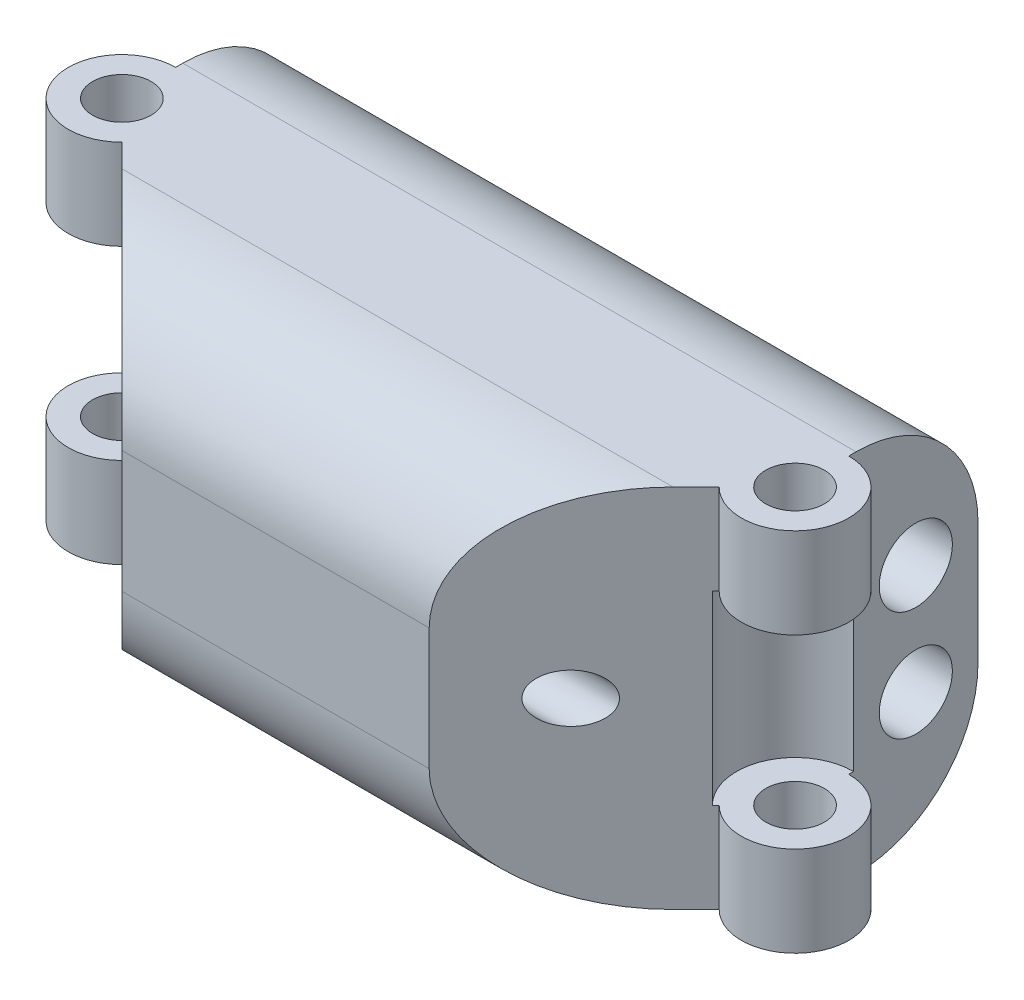
from build123d import *

# Parameters (mm, degrees)
BOSS_EXTRUDE1_DEPTH            = 7.5
BOSS_EXTRUDE1_DEPTH_BACK       = 7.5
CUT_EXTRUDE3_REACH             = 31.568
SKETCH5_R                      = 1.5
FILLET1_R                      = 5
CUT_EXTRUDE2_REACH             = 19.405
SKETCH3_R                      = 1
CUT_EXTRUDE2_DIRECTION_2_REACH = 19.405
FILLET2_R                      = 5
BOSS_EXTRUDE2_START            = 3.8
SKETCH6_R                      = 1.2
BOSS_EXTRUDE2_DEPTH            = 3.7
BOSS_EXTRUDE3_START            = -7.5
SKETCH6_4_R                    = 1.2
BOSS_EXTRUDE3_DEPTH            = 3.7


with BuildPart() as part:
    # Sketch1 → Boss-Extrude1 (new, two sides: drawn at the far end of the back side and taken through both)
    with BuildSketch(Plane(origin=(0, 0, 0), x_dir=(-1, 0, 0), z_dir=(0, 1, 0)).offset(-BOSS_EXTRUDE1_DEPTH_BACK)):
        with BuildLine():
            Line((6.3, 7.5), (-6.3, 7.5))
            Line((-6.3, 7.5), (-12.102943725, 1.697056275))
            ThreePointArc((-12.102943725, 1.697056275), (-11.582689122, -0.918440238), (-13.8, -2.4))
            Line((-13.8, -2.4), (-13.8, -7.5))
            Line((-13.8, -7.5), (13.8, -7.5))
            Line((13.8, -7.5), (13.8, -2.4))
            ThreePointArc((13.8, -2.4), (11.582689122, -0.918440238), (12.102943725, 1.697056275))
            Line((12.102943725, 1.697056275), (6.3, 7.5))
        make_face()
    extrude(amount=BOSS_EXTRUDE1_DEPTH + BOSS_EXTRUDE1_DEPTH_BACK)

    # Sketch5 → Cut-Extrude3 (cut, up to next)
    with BuildSketch(Plane.YZ.offset(13.8), mode=Mode.PRIVATE) as cut_extrude3_sk1:
        with Locations((-2.25, -4.95)):
            Circle(SKETCH5_R)
    cut_extrude3_tool1 = extrude(cut_extrude3_sk1.sketch, amount=-CUT_EXTRUDE3_REACH, mode=Mode.PRIVATE) & part.part
    # Sketch5 → Cut-Extrude3 (cut, up to next)
    with BuildSketch(Plane.YZ.offset(13.8), mode=Mode.PRIVATE) as cut_extrude3_sk2:
        with Locations((2.25, -4.95)):
            Circle(SKETCH5_R)
    cut_extrude3_tool2 = extrude(cut_extrude3_sk2.sketch, amount=-CUT_EXTRUDE3_REACH, mode=Mode.PRIVATE) & part.part
    add(cut_extrude3_tool1.solids().sort_by_distance((13.8, -2.25, -4.95))[0], mode=Mode.SUBTRACT)
    add(cut_extrude3_tool2.solids().sort_by_distance((13.8, 2.25, -4.95))[0], mode=Mode.SUBTRACT)

    # Fillet1
    fillet1_edges = [part.edges().sort_by_distance(p)[0] for p in [
        (0, -7.5, -7.5),
        (0, 7.5, -7.5),
    ]]
    fillet(fillet1_edges, radius=FILLET1_R)

    # Sketch3 → Cut-Extrude2 (cut, up to next)
    with BuildSketch(Plane.YZ, mode=Mode.PRIVATE) as cut_extrude2_sk1:
        with Locations((0, 4.598528137)):
            Circle(SKETCH3_R)
    cut_extrude2_tool1 = extrude(cut_extrude2_sk1.sketch, amount=-CUT_EXTRUDE2_REACH, mode=Mode.PRIVATE) & part.part
    add(cut_extrude2_tool1.solids().sort_by_distance((0, 0, 4.598528))[0], mode=Mode.SUBTRACT)

    # Sketch3 → Cut-Extrude2 direction 2 (cut, up to next)
    with BuildSketch(Plane.YZ, mode=Mode.PRIVATE) as cut_extrude2_direction_2_sk1:
        with Locations((0, 4.598528137)):
            Circle(SKETCH3_R)
    cut_extrude2_direction_2_tool1 = extrude(cut_extrude2_direction_2_sk1.sketch, amount=CUT_EXTRUDE2_DIRECTION_2_REACH, mode=Mode.PRIVATE) & part.part
    add(cut_extrude2_direction_2_tool1.solids().sort_by_distance((0, 0, 4.598528))[0], mode=Mode.SUBTRACT)

    # Fillet2
    fillet2_edges = [part.edges().sort_by_distance(p)[0] for p in [
        (0, 7.5, 7.5),
        (0, -7.5, 7.5),
    ]]
    fillet(fillet2_edges, radius=FILLET2_R)

    # Sketch6 → Boss-Extrude2 (add)
    # profile 1 of 2: a face of its own
    with BuildSketch(Plane(origin=(0, 0, 0), x_dir=(-1, 0, 0), z_dir=(0, 1, 0)).offset(BOSS_EXTRUDE2_START)):
        with BuildLine():
            Line((-12.102943725, 1.697056275), (-12.244365081, 1.555634919))
            ThreePointArc((-12.244365081, 1.555634919), (-15.832534972, 0.841903551), (-13.8, -2.2))
            Line((-13.8, -2.2), (-13.8, -2.4))
            ThreePointArc((-13.8, -2.4), (-11.582689122, -0.918440238), (-12.102943725, 1.697056275))
        make_face()
        with Locations((-13.8, 0)):
            Circle(SKETCH6_R, mode=Mode.SUBTRACT)
    # profile 2 of 2: a face of its own
    with BuildSketch(Plane(origin=(0, 0, 0), x_dir=(-1, 0, 0), z_dir=(0, 1, 0)).offset(BOSS_EXTRUDE2_START)):
        with BuildLine():
            Line((13.8, -2.4), (13.8, -2.2))
            ThreePointArc((13.8, -2.2), (15.832534972, 0.841903551), (12.244365081, 1.555634919))
            Line((12.244365081, 1.555634919), (12.102943725, 1.697056275))
            ThreePointArc((12.102943725, 1.697056275), (11.582689122, -0.918440238), (13.8, -2.4))
        make_face()
        with Locations((13.8, 0)):
            Circle(SKETCH6_R, mode=Mode.SUBTRACT)
    extrude(amount=BOSS_EXTRUDE2_DEPTH)

    # Sketch6<4> → Boss-Extrude3 (add)
    # profile 1 of 2: a face of its own
    with BuildSketch(Plane(origin=(0, 0, 0), x_dir=(-1, 0, 0), z_dir=(0, 1, 0)).offset(BOSS_EXTRUDE3_START)):
        with BuildLine():
            Line((-12.102943725, 1.697056275), (-12.244365081, 1.555634919))
            ThreePointArc((-12.244365081, 1.555634919), (-15.832534972, 0.841903551), (-13.8, -2.2))
            Line((-13.8, -2.2), (-13.8, -2.4))
            ThreePointArc((-13.8, -2.4), (-11.582689122, -0.918440238), (-12.102943725, 1.697056275))
        make_face()
        with Locations((-13.8, 0)):
            Circle(SKETCH6_4_R, mode=Mode.SUBTRACT)
    # profile 2 of 2: a face of its own
    with BuildSketch(Plane(origin=(0, 0, 0), x_dir=(-1, 0, 0), z_dir=(0, 1, 0)).offset(BOSS_EXTRUDE3_START)):
        with BuildLine():
            Line((13.8, -2.4), (13.8, -2.2))
            ThreePointArc((13.8, -2.2), (15.832534972, 0.841903551), (12.244365081, 1.555634919))
            Line((12.244365081, 1.555634919), (12.102943725, 1.697056275))
            ThreePointArc((12.102943725, 1.697056275), (11.582689122, -0.918440238), (13.8, -2.4))
        make_face()
        with Locations((13.8, 0)):
            Circle(SKETCH6_4_R, mode=Mode.SUBTRACT)
    extrude(amount=BOSS_EXTRUDE3_DEPTH)


solid = part.part
